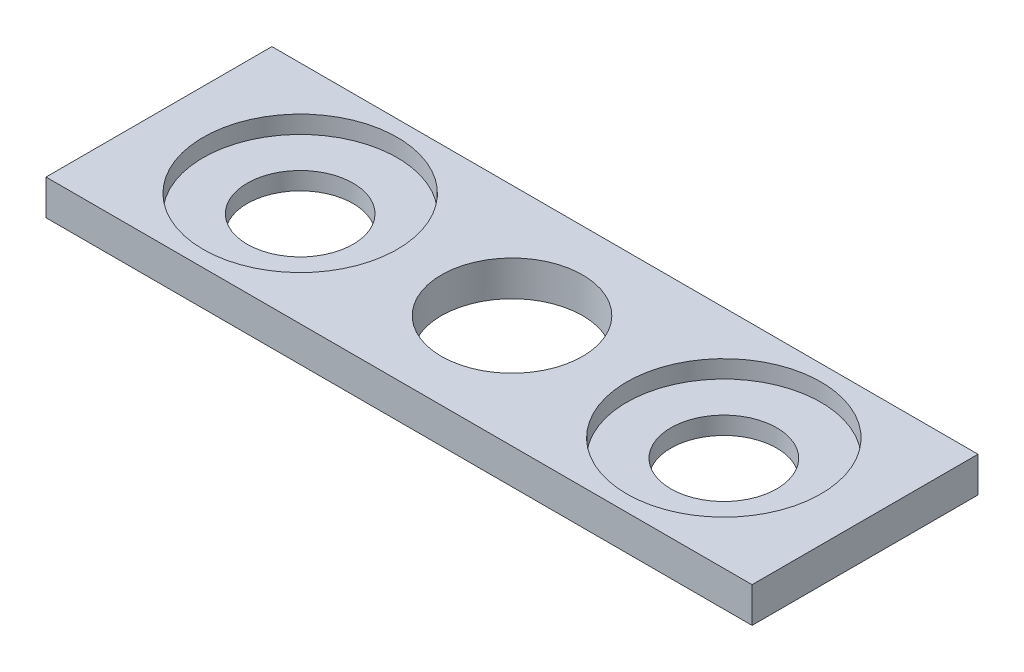
from build123d import *

# Parameters (mm, degrees)
SKETCH1_W           = 63.5
SKETCH1_H           = 20.32
SKETCH1_R           = 4.7625
BOSS_EXTRUDE1_DEPTH = 3.175
SKETCH2_R           = 6.35
CUT_EXTRUDE1_DEPTH  = 6.35
SKETCH3_R           = 8.73125
CUT_EXTRUDE2_DEPTH  = 1.5875


with BuildPart() as part:
    # Sketch1 → Boss-Extrude1 (new body)
    with BuildSketch(Plane(origin=(0, 0, 0), x_dir=(1, 0, 0), z_dir=(0, 1, 0))):
        with Locations((31.75, 10.16)):
            Rectangle(SKETCH1_W, SKETCH1_H)
        with Locations(Location((12.7, 10.16, 0), (0, 0, 270))):
            Circle(SKETCH1_R, mode=Mode.SUBTRACT)
        with Locations(Location((50.8, 10.16, 0), (0, 0, 270))):
            Circle(SKETCH1_R, mode=Mode.SUBTRACT)
    extrude(amount=BOSS_EXTRUDE1_DEPTH)

    # Sketch2 → Cut-Extrude1 (cut)
    with BuildSketch(Plane(origin=(0, 3.175, 0), x_dir=(1, 0, 0), z_dir=(0, 1, 0))):
        with Locations(Location((31.75, 10.16, 0), (0, 0, 270))):
            Circle(SKETCH2_R)
    extrude(amount=-CUT_EXTRUDE1_DEPTH, mode=Mode.SUBTRACT)

    # Sketch3 → Cut-Extrude2 (cut)
    with BuildSketch(Plane(origin=(0, 3.175, 0), x_dir=(1, 0, 0), z_dir=(0, 1, 0))):
        with Locations(Location((12.7, 10.16, 0), (0, 0, 270))):
            Circle(SKETCH3_R)
        with Locations(Location((50.8, 10.16, 0), (0, 0, 270))):
            Circle(SKETCH3_R)
    extrude(amount=-CUT_EXTRUDE2_DEPTH, mode=Mode.SUBTRACT)


solid = part.part
